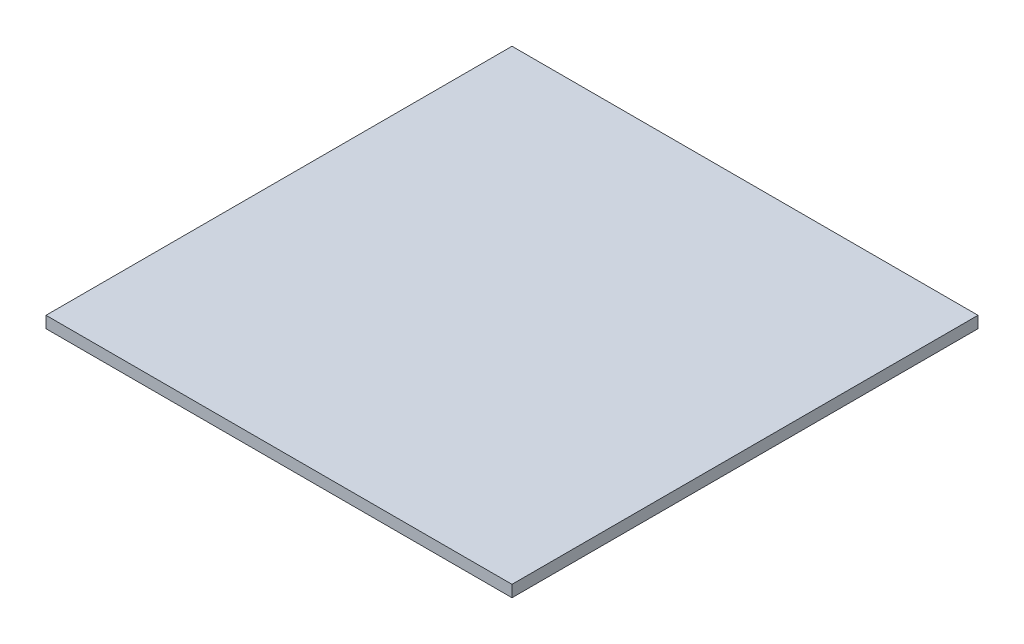
from build123d import *

# Parameters (mm, degrees)
SKETCH_1_W      = 1000
SKETCH_1_H      = 1000
EXTRUDE_1_DEPTH = 25


with BuildPart() as part:
    # 草图1 → 凸台-拉伸1 (new body)
    with BuildSketch(Plane(origin=(0, 0, 0), x_dir=(1, 0, 0), z_dir=(0, 1, 0))):
        Rectangle(SKETCH_1_W, SKETCH_1_H)
    extrude(amount=EXTRUDE_1_DEPTH)


solid = part.part
